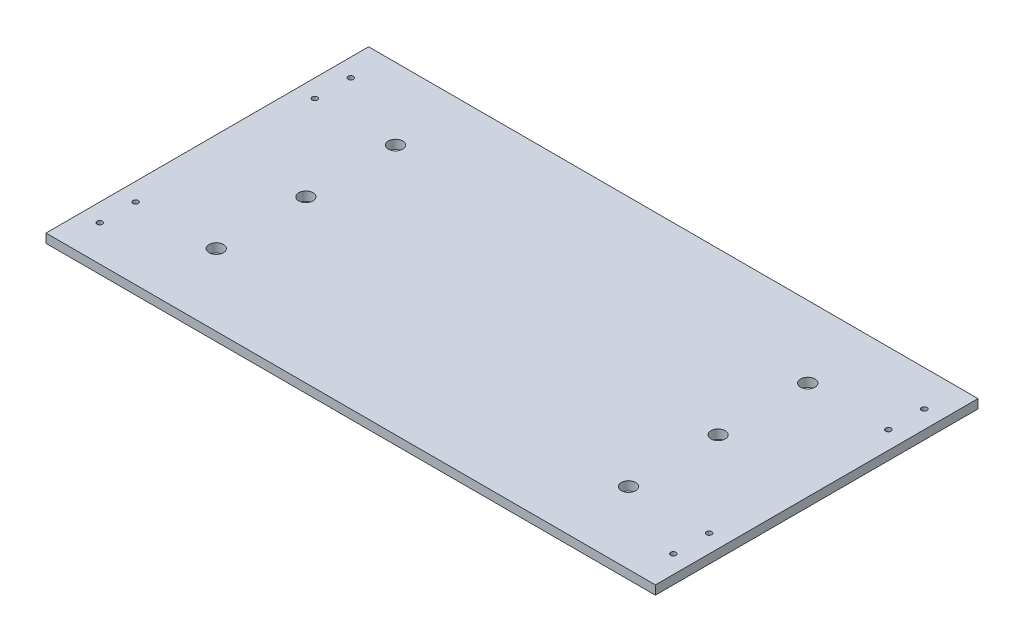
from build123d import *

# Parameters (mm, degrees)
SKETCH_1_W          = 340
SKETCH_1_H          = 180
EXTRUDE_1_DEPTH     = 5
SKETCH_2_R          = 1.5
CUT_EXTRUDE_1_DEPTH = 5
SKETCH_4_R          = 4
CUT_EXTRUDE_2_DEPTH = 5


with BuildPart() as part:
    # 草图1 → 凸台-拉伸1 (new body)
    with BuildSketch(Plane(origin=(0, 0, 0), x_dir=(1, 0, 0), z_dir=(0, 1, 0))):
        with Locations((-170, 90)):
            Rectangle(SKETCH_1_W, SKETCH_1_H)
    extrude(amount=EXTRUDE_1_DEPTH)

    # 草图2 → 切除-拉伸1 (cut)
    with BuildSketch(Plane(origin=(0, 5, 0), x_dir=(1, 0, 0), z_dir=(0, 1, 0))):
        with Locations(Location((-330, 20, 0), (0, 0, 270))):
            Circle(SKETCH_2_R)
        with Locations(Location((-330, 40, 0), (0, 0, 270))):
            Circle(SKETCH_2_R)
        with Locations(Location((-330, 140, 0), (0, 0, 90))):
            Circle(SKETCH_2_R)
        with Locations(Location((-330, 160, 0), (0, 0, 90))):
            Circle(SKETCH_2_R)
        with Locations(Location((-10, 160, 0), (0, 0, 270))):
            Circle(SKETCH_2_R)
        with Locations(Location((-10, 140, 0), (0, 0, 270))):
            Circle(SKETCH_2_R)
        with Locations(Location((-10, 40, 0), (0, 0, 90))):
            Circle(SKETCH_2_R)
        with Locations(Location((-10, 20, 0), (0, 0, 90))):
            Circle(SKETCH_2_R)
    extrude(amount=-CUT_EXTRUDE_1_DEPTH, mode=Mode.SUBTRACT)

    # 草图4 → 切除-拉伸2 (cut)
    with BuildSketch(Plane(origin=(0, 5, 0), x_dir=(1, 0, 0), z_dir=(0, 1, 0))):
        with Locations(Location((-285, 140, 0), (0, 0, 270))):
            Circle(SKETCH_4_R)
        with Locations(Location((-285, 90, 0), (0, 0, 270))):
            Circle(SKETCH_4_R)
        with Locations(Location((-285, 40, 0), (0, 0, 270))):
            Circle(SKETCH_4_R)
        with Locations(Location((-55, 40, 0), (0, 0, 90))):
            Circle(SKETCH_4_R)
        with Locations(Location((-55, 90, 0), (0, 0, 90))):
            Circle(SKETCH_4_R)
        with Locations(Location((-55, 140, 0), (0, 0, 90))):
            Circle(SKETCH_4_R)
    extrude(amount=-CUT_EXTRUDE_2_DEPTH, mode=Mode.SUBTRACT)


solid = part.part
